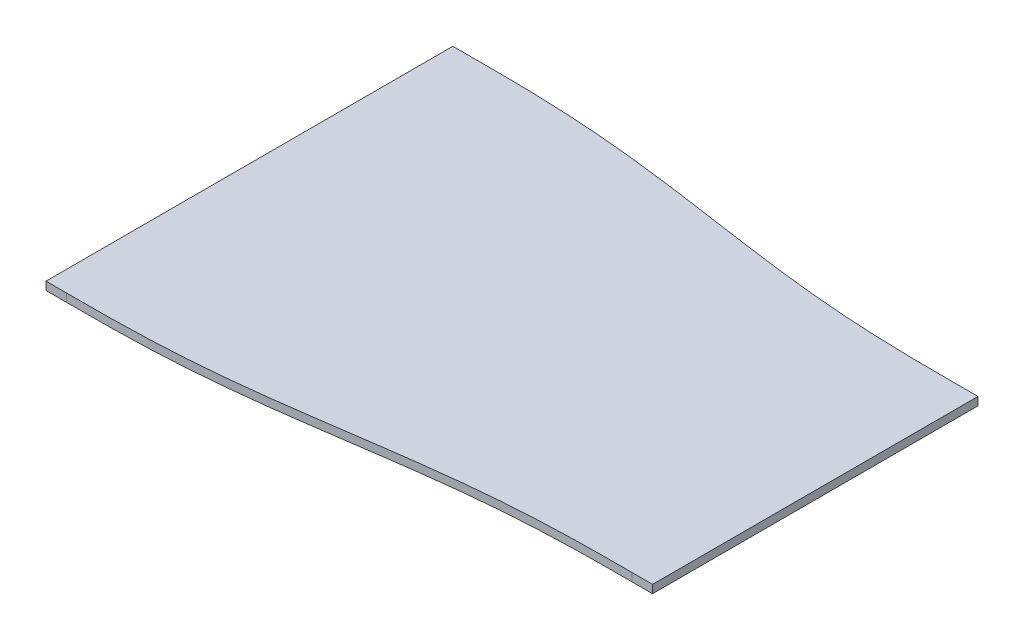
from build123d import *

# Parameters (mm, degrees)
BOSS_EXTRUDE1_DEPTH = 10


with BuildPart() as part:
    # Sketch2 → Boss-Extrude1 (new body)
    with BuildSketch(Plane(origin=(0, 0, 0), x_dir=(1, 0, 0), z_dir=(0, 1, 0))):
        with BuildLine():
            Line((644.65, -200), (670.05, -200))
            Line((670.05, -200), (670.05, 200))
            Line((670.05, 200), (644.65, 200))
            add(Edge.make_bspline(
                [(0, 250), (2.521112677, 250), (6.209600906, 250.000000013), (15.016507291, 249.997525286), (20.396277848, 249.984804824), (27.70356243, 249.966782803), (32.958409359, 249.938976051), (39.469019484, 249.899575195), (45.353978298, 249.846095557), (51.697739738, 249.776222765), (59.577798777, 249.665078925), (72.055387865, 249.438693031), (88.938380089, 249.000224322), (110.277077943, 248.177942168), (134.422777808, 246.851031881), (158.55027755, 245.118473578), (182.641737439, 242.990791615), (208.646910269, 240.294638586), (234.607319329, 237.210998029), (260.529589307, 233.816247037), (286.421101664, 230.202184451), (310.358989888, 226.746607494), (334.291027152, 223.253392129), (358.228844737, 219.797816743), (384.120515654, 216.183750571), (410.042516088, 212.789005998), (433.001107322, 210.061958697), (452.986247288, 207.944588912), (471.042219017, 206.211322516), (489.117075126, 204.66496144), (510.224122789, 203.148964488), (531.359153773, 201.987923337), (549.478620255, 201.239741285), (564.778145102, 200.764489073), (575.615150606, 200.506371685), (585.077126141, 200.334920277), (592.950274347, 200.223777792), (599.293422889, 200.153904026), (605.18988803, 200.10042507), (611.673694072, 200.061023789), (616.977186653, 200.033217286), (624.206757774, 200.015195133), (629.71276906, 200.002474739), (638.382457019, 199.999999985), (642.128887323, 200), (644.65, 200)],
                knots=[0.083042309, 0.083042309, 0.083042309, 0.083042309, 0.083042309, 0.098618931, 0.106407242, 0.114195554, 0.121983865, 0.129772176, 0.137560487, 0.145348798, 0.153607863, 0.161866929, 0.17838506, 0.209538303, 0.240691546, 0.271844787, 0.302998032, 0.334151279, 0.365304526, 0.406540267, 0.437693511, 0.468846755, 0.5, 0.531153245, 0.562306489, 0.593459733, 0.634695474, 0.665848721, 0.681425345, 0.697001968, 0.728155213, 0.759308454, 0.790461697, 0.806038319, 0.82161494, 0.838133071, 0.846392137, 0.854651202, 0.862439513, 0.870227824, 0.878016135, 0.885804446, 0.893592758, 0.901381069, 0.916957691, 0.916957691, 0.916957691, 0.916957691, 0.916957691], degree=4))
            Line((0, 250), (-25.4, 250))
            Line((-25.4, 250), (-25.4, -250))
            Line((-25.4, -250), (0, -250))
            add(Edge.make_bspline(
                [(0, -250), (2.521112677, -250), (6.209600906, -250.000000013), (15.016507291, -249.997525286), (20.396277848, -249.984804824), (27.70356243, -249.966782803), (32.958409359, -249.938976051), (39.469019484, -249.899575195), (45.353978298, -249.846095557), (51.697739738, -249.776222765), (59.577798777, -249.665078925), (72.055387865, -249.438693031), (88.938380089, -249.000224322), (110.277077943, -248.177942168), (134.422777808, -246.851031881), (158.550277549, -245.118473579), (182.641737439, -242.990791616), (208.646910269, -240.294638586), (234.607319329, -237.210998029), (260.529589307, -233.816247037), (286.421101664, -230.202184451), (310.358989888, -226.746607494), (334.291027152, -223.253392129), (358.228844737, -219.797816743), (384.120515654, -216.183750571), (410.042516088, -212.789005998), (433.001107322, -210.061958698), (452.986247288, -207.944588912), (471.042219017, -206.211322517), (489.117075126, -204.66496144), (510.224122789, -203.148964488), (531.359153773, -201.987923337), (549.478620255, -201.239741285), (564.778145102, -200.764489073), (575.615150606, -200.506371685), (585.077126141, -200.334920277), (592.950274347, -200.223777792), (599.293422889, -200.153904027), (605.18988803, -200.10042507), (611.673694072, -200.061023789), (616.977186653, -200.033217286), (624.206757774, -200.015195133), (629.71276906, -200.002474739), (638.382457019, -199.999999985), (642.128887323, -200), (644.65, -200)],
                knots=[0.083042309, 0.083042309, 0.083042309, 0.083042309, 0.083042309, 0.098618931, 0.106407242, 0.114195554, 0.121983865, 0.129772176, 0.137560487, 0.145348798, 0.153607863, 0.161866929, 0.17838506, 0.209538303, 0.240691546, 0.271844787, 0.302998032, 0.334151279, 0.365304526, 0.406540267, 0.437693511, 0.468846755, 0.5, 0.531153245, 0.562306489, 0.593459733, 0.634695474, 0.665848721, 0.681425345, 0.697001968, 0.728155213, 0.759308454, 0.790461697, 0.806038319, 0.82161494, 0.838133071, 0.846392137, 0.854651202, 0.862439513, 0.870227824, 0.878016135, 0.885804446, 0.893592758, 0.901381069, 0.916957691, 0.916957691, 0.916957691, 0.916957691, 0.916957691], degree=4))
        make_face()
    extrude(amount=BOSS_EXTRUDE1_DEPTH)


solid = part.part
